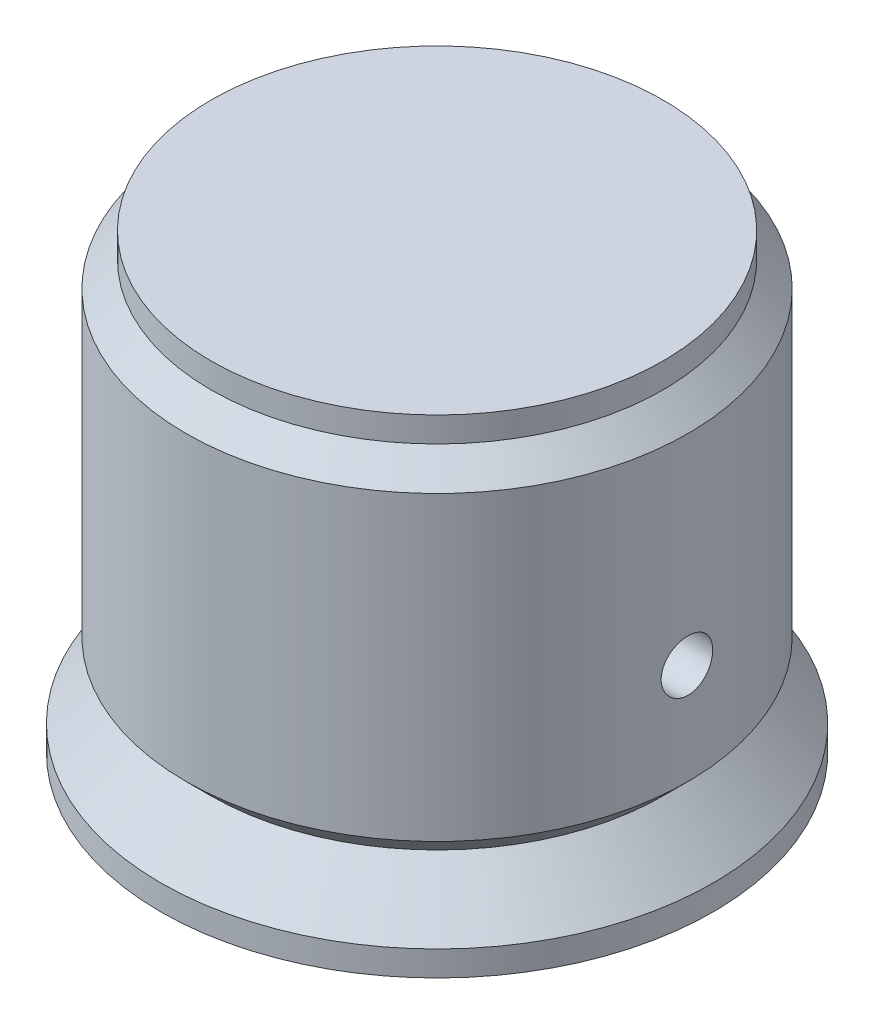
from build123d import *

# Parameters (mm, degrees)
SKETCH2_W = 8.73125
SKETCH2_H = 0.81407
SKETCH3_W = 8.73125
SKETCH3_H = 0.37084


with BuildPart() as part:
    # Sketch1 → BODY (revolve)
    with BuildSketch(Plane.XY, mode=Mode.PRIVATE) as body_sk:
        Polygon((7.14375, 14.2875), (7.14375, 13.49375), (7.9375, 12.7), (7.9375, 3.175), (7.14375, 2.38125), (8.73125, 0.79375), (8.73125, 0), (0, 0), (0, 14.2875), align=None)
    revolve(body_sk.sketch.rotate(Axis((0, 17.35888354, 0), (0, -1, 0)), 90), axis=Axis((0, 17.35888354, 0), (0, -1, 0)))

    # Sketch6 → BORE-1 (revolve, cut)
    with BuildSketch(Plane.XY, mode=Mode.PRIVATE) as bore_1_sk:
        Polygon((0, 13.49375), (1.26746, 12.761981628), (1.26746, 12.444481628), (1.58496, 12.444481628), (1.58496, 0.635), (2.21996, 0), (0, 0), align=None)
    revolve(bore_1_sk.sketch.rotate(Axis((0, 13.952718453, 0), (0, -1, 0)), 90), axis=Axis((0, 13.952718453, 0), (0, -1, 0)), mode=Mode.SUBTRACT)

    # Sketch2 → SET SCREW (revolve, cut)
    with BuildSketch(Plane.XY, mode=Mode.PRIVATE) as set_screw_sk:
        with Locations((4.365625, 6.757035)):
            Rectangle(SKETCH2_W, SKETCH2_H)
    revolve(set_screw_sk.sketch.rotate(Axis((-2.248807984, 6.35, 0), (1, 0, 0)), 90), axis=Axis((-2.248807984, 6.35, 0), (1, 0, 0)), mode=Mode.SUBTRACT)

    # Sketch3 → SUB DRILL (revolve, cut)
    with BuildSketch(Plane(origin=(0, 0, 0), x_dir=(0, 0, -1), z_dir=(1, 0, 0)), mode=Mode.PRIVATE) as sub_drill_sk:
        with Locations((4.365625, 6.53542)):
            Rectangle(SKETCH3_W, SKETCH3_H)
    revolve(sub_drill_sk.sketch.rotate(Axis((0, 6.35, 0), (0, 0, -1)), 90), axis=Axis((0, 6.35, 0), (0, 0, -1)), mode=Mode.SUBTRACT)


solid = part.part
